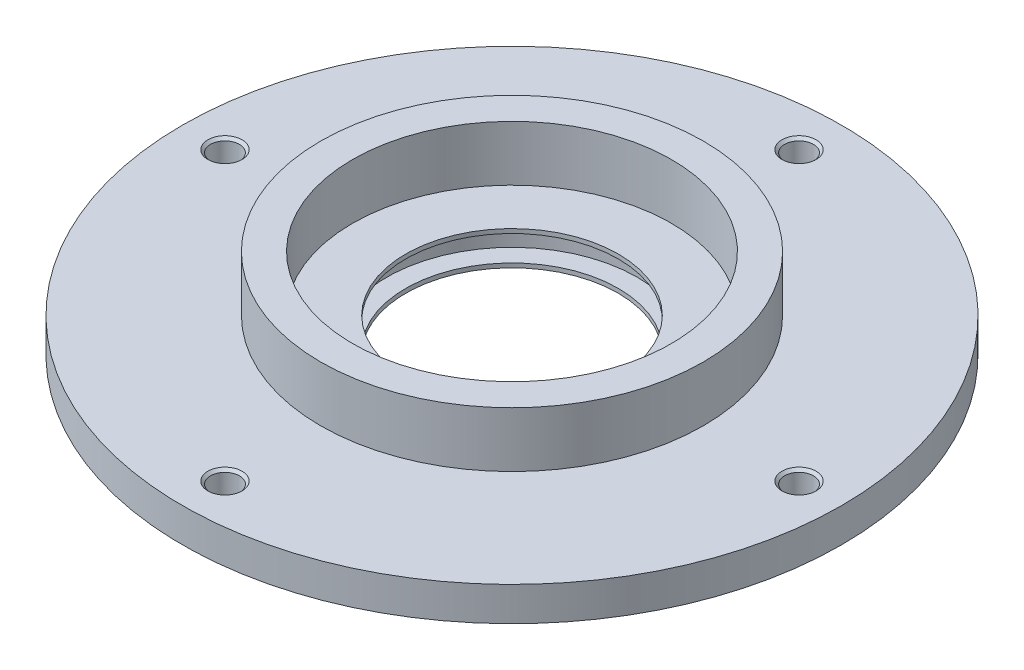
from build123d import *

# Parameters (mm, degrees)
HOLE_WIZARD_M8_1_D           = 6.8
HOLE_WIZARD_M8_1_CSINK_D     = 8.05
HOLE_WIZARD_M8_1_CSINK_ANGLE = 90
SKETCH_3_R                   = 25
CUT_EXTRUDE_3_DEPTH          = 21


with BuildPart() as part:
    # 草图1 → 旋转1 (revolve)
    with BuildSketch(Plane.XY, mode=Mode.PRIVATE) as revolve_1_sk:
        Polygon((0, 0), (77.5, 0), (77.5, 8), (45, 8), (45, 21), (37.5, 21), (37.5, 8), (0, 8), align=None)
    revolve(revolve_1_sk.sketch.rotate(Axis((0, 8, 0), (0, -1, 0)), 180), axis=Axis((0, 8, 0), (0, -1, 0)))

    # M8 螺纹孔1 (through all)
    with Locations(Plane(origin=(0, 8, 0), x_dir=(1, 0, 0), z_dir=(0, 1, 0))):
        with Locations((-67.5, 0), (67.5, 0), (0, -67.5), (0, 67.5)):
            CounterSinkHole(HOLE_WIZARD_M8_1_D / 2, HOLE_WIZARD_M8_1_CSINK_D / 2, counter_sink_angle=HOLE_WIZARD_M8_1_CSINK_ANGLE)

    # 草图3 → 切除-拉伸3 (cut)
    with BuildSketch(Plane(origin=(0, 0, 0), x_dir=(1, 0, 0), z_dir=(0, 1, 0))):
        Circle(SKETCH_3_R)
    extrude(amount=CUT_EXTRUDE_3_DEPTH, mode=Mode.SUBTRACT)

    # 草图4 → 切除-旋转2 (revolve, cut)
    with BuildSketch(Plane(origin=(0, 0, 0), x_dir=(0, 0, -1), z_dir=(1, 0, 0))):
        Polygon((14.5, 7), (14.5, 1), (25, 1), (29.5, 1), (29.5, 4), (29.5, 7), (25, 7), align=None)
    revolve(axis=Axis((0, 0, 0), (0, 1, 0)), mode=Mode.SUBTRACT)


solid = part.part
